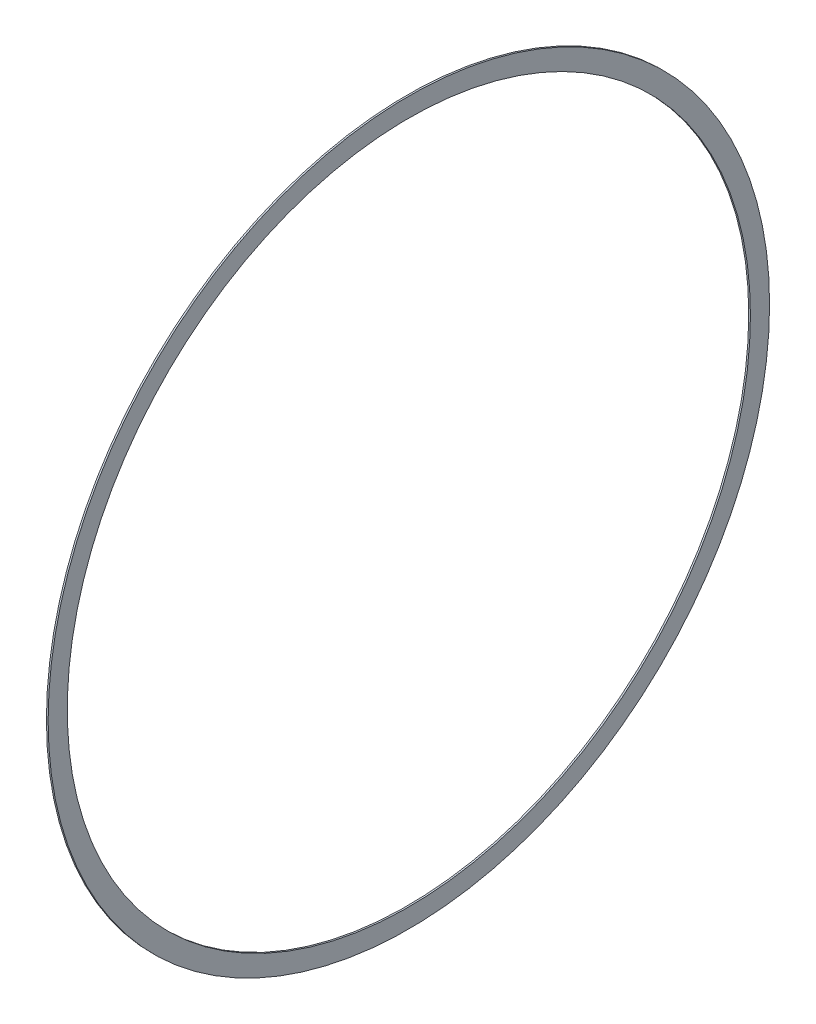
from build123d import *

# Parameters (mm, degrees)
SKETCH1_R           = 848
SKETCH1_R_2         = 803
BOSS_EXTRUDE1_DEPTH = 4


with BuildPart() as part:
    # Sketch1 → Boss-Extrude1 (new body)
    with BuildSketch(Plane(origin=(0, 0, 0), x_dir=(0, 0, -1), z_dir=(1, 0, 0))):
        Circle(SKETCH1_R)
        Circle(SKETCH1_R_2, mode=Mode.SUBTRACT)
    extrude(amount=BOSS_EXTRUDE1_DEPTH)


solid = part.part
